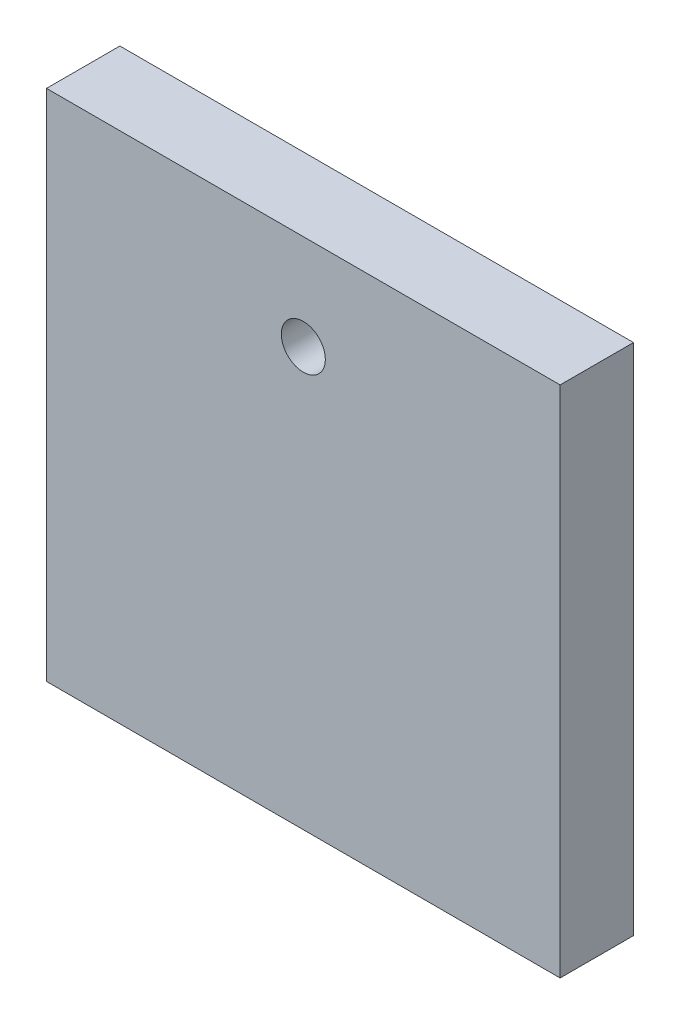
from build123d import *

# Parameters (mm, degrees)
SKETCH2_W               = 35
SKETCH2_H               = 35
BOSS_EXTRUDE1_DEPTH     = 5
CUT_EXTRUDE1_DEPTH      = 26.248762346
CUT_EXTRUDE1_DEPTH_BACK = 26.248762346
SKETCH3_R               = 1.5


with BuildPart() as part:
    # Sketch2 → Boss-Extrude1 (new body)
    with BuildSketch(Plane.XY):
        Rectangle(SKETCH2_W, SKETCH2_H)
    extrude(amount=BOSS_EXTRUDE1_DEPTH)

    # Sketch3 → Cut-Extrude1 (cut, two sides: drawn at the far end of the back side and taken through both)
    with BuildSketch(Plane.XY.offset(5).offset(-CUT_EXTRUDE1_DEPTH_BACK)):
        with Locations((0, 11)):
            Circle(SKETCH3_R)
    extrude(amount=CUT_EXTRUDE1_DEPTH + CUT_EXTRUDE1_DEPTH_BACK, mode=Mode.SUBTRACT)


solid = part.part
